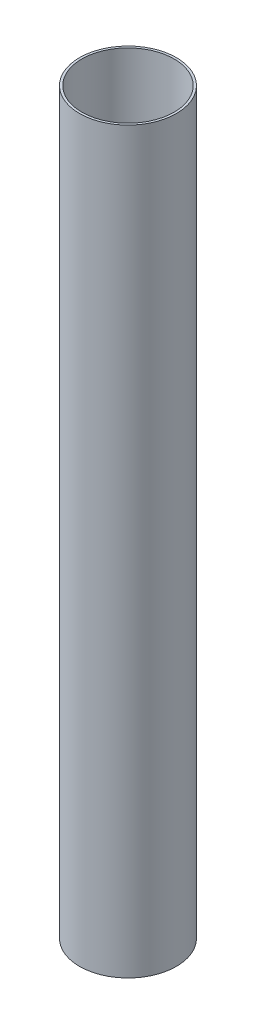
from build123d import *

# Parameters (mm, degrees)
SKETCH1_R           = 33.3248
SKETCH1_R_2         = 31.75
BOSS_EXTRUDE1_DEPTH = 508


with BuildPart() as part:
    # Sketch1 → Boss-Extrude1 (new body)
    with BuildSketch(Plane(origin=(0, 0, 0), x_dir=(1, 0, 0), z_dir=(0, 1, 0))):
        with Locations(Location((0, 0, 0), (0, 0, 270))):
            Circle(SKETCH1_R)
        with Locations(Location((0, 0, 0), (0, 0, 270))):
            Circle(SKETCH1_R_2, mode=Mode.SUBTRACT)
    extrude(amount=BOSS_EXTRUDE1_DEPTH)


solid = part.part
